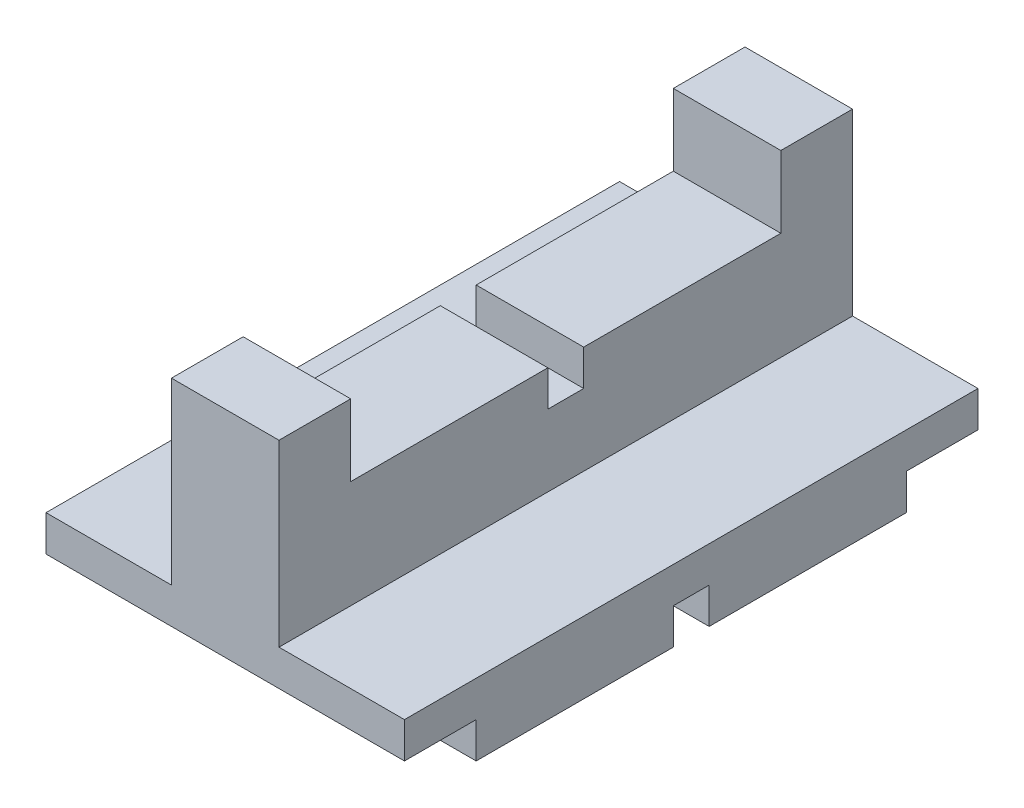
from build123d import *

# Parameters (mm, degrees)
BOSS_EXTRUDE1_DEPTH = 80
SKETCH4_W           = 60
SKETCH4_H           = 10
CUT_EXTRUDE1_DEPTH  = 90.895772982
SKETCH9_W           = 10
SKETCH9_H           = 5
CUT_EXTRUDE6_DEPTH  = 98.59610648
SKETCH10_W          = 10
SKETCH10_H          = 5
CUT_EXTRUDE7_DEPTH  = 98.59610648
SKETCH12_W          = 5
SKETCH12_H          = 5
CUT_EXTRUDE9_DEPTH  = 98.59610648
SKETCH6_W           = 5
SKETCH6_H           = 5
CUT_EXTRUDE11_DEPTH = 90.895772982


with BuildPart() as part:
    # Sketch1 → Boss-Extrude1 (new body)
    with BuildSketch(Plane.XY):
        Polygon((-7.860697776, 0), (-25.360697776, 0), (-25.360697776, -10), (24.639302224, -10), (24.639302224, 0), (7.139302224, 0), (7.139302224, 25), (-7.860697776, 25), align=None)
    extrude(amount=BOSS_EXTRUDE1_DEPTH)

    # Sketch4 → Cut-Extrude1 (cut, through all)
    with BuildSketch(Plane(origin=(7.139302224, 0, 0), x_dir=(0, 0, -1), z_dir=(1, 0, 0))):
        with Locations((-40, 20)):
            Rectangle(SKETCH4_W, SKETCH4_H)
    extrude(amount=-CUT_EXTRUDE1_DEPTH, mode=Mode.SUBTRACT)

    # Sketch9 → Cut-Extrude6 (cut, through all)
    with BuildSketch(Plane(origin=(24.639302224, 0, 0), x_dir=(0, 0, -1), z_dir=(1, 0, 0))):
        with Locations((-75, -7.5)):
            Rectangle(SKETCH9_W, SKETCH9_H)
    extrude(amount=-CUT_EXTRUDE6_DEPTH, mode=Mode.SUBTRACT)

    # Sketch10 → Cut-Extrude7 (cut, through all)
    with BuildSketch(Plane(origin=(24.639302224, 0, 0), x_dir=(0, 0, -1), z_dir=(1, 0, 0))):
        with Locations((-5, -7.5)):
            Rectangle(SKETCH10_W, SKETCH10_H)
    extrude(amount=-CUT_EXTRUDE7_DEPTH, mode=Mode.SUBTRACT)

    # Sketch12 → Cut-Extrude9 (cut, through all)
    with BuildSketch(Plane(origin=(24.639302224, 0, 0), x_dir=(0, 0, -1), z_dir=(1, 0, 0))):
        with Locations((-39.999750499, -7.5)):
            Rectangle(SKETCH12_W, SKETCH12_H)
    extrude(amount=-CUT_EXTRUDE9_DEPTH, mode=Mode.SUBTRACT)

    # Sketch6 → Cut-Extrude11 (cut, through all)
    with BuildSketch(Plane(origin=(7.139302224, 0, 0), x_dir=(0, 0, -1), z_dir=(1, 0, 0))):
        with Locations((-39.999750499, 12.5)):
            Rectangle(SKETCH6_W, SKETCH6_H)
    extrude(amount=-CUT_EXTRUDE11_DEPTH, mode=Mode.SUBTRACT)


solid = part.part
